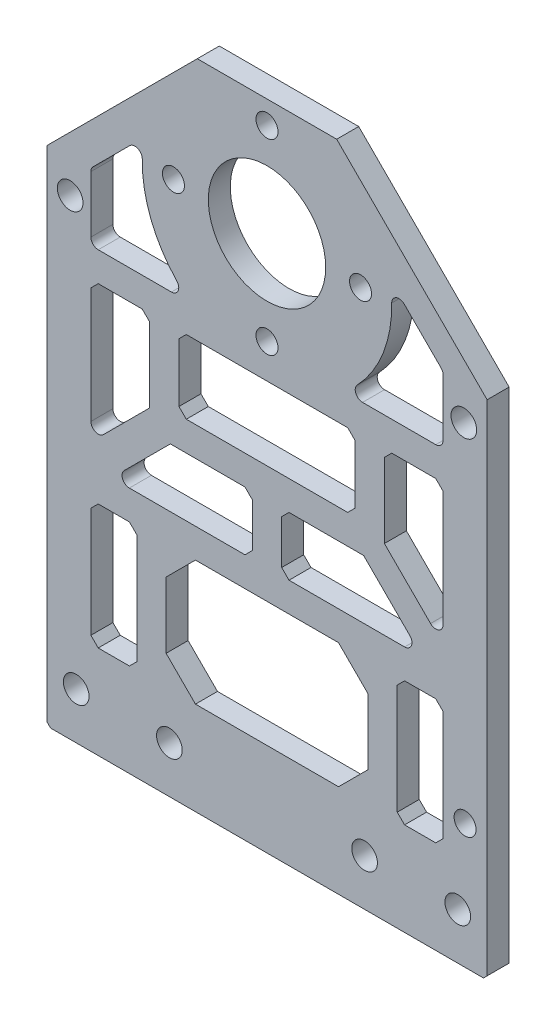
from build123d import *

# Parameters (mm, degrees)
ESBO_O1_R                = 16
RESSALTO_EXTRUS_O1_DEPTH = 6
ESBO_O2_R                = 3
ESBO_O2_W                = 55
ESBO_O2_H                = 34
ESBO_O2_W_2              = 48
ESBO_O2_H_2              = 20
ESBO_O2_W_3              = 12.5
CORTE_EXTRUS_O1_DEPTH    = 215.755675129
RESSALTO_EXTRUS_O2_DEPTH = 6
ESBO_O4_R                = 3.5
CORTE_EXTRUS_O2_DEPTH    = 215.755675129
FILETE1_R                = 2
CHANFRO1_SIZE            = 8
CHANFRO2_SIZE            = 2
ESBO_O5_R                = 3.5
CORTE_EXTRUS_O3_DEPTH    = 215.755675129
CHANFRO3_SIZE            = 1
ESBO_O8_R                = 3
CORTE_EXTRUS_O5_DEPTH    = 215.755675129


with BuildPart() as part:
    # Esboço1 → Ressalto-extrusão1 (new body)
    with BuildSketch(Plane.XY):
        Polygon((0, 0), (0, 137), (41, 178), (79, 178), (120, 137), (120, 0), align=None)
        with Locations((60, 146.25)):
            Circle(ESBO_O1_R, mode=Mode.SUBTRACT)
    extrude(amount=RESSALTO_EXTRUS_O1_DEPTH)

    # Esboço2 → Corte-extrusão1 (cut, through all)
    with BuildSketch(Plane(origin=(0, 0, 0), x_dir=(-1, 0, 0), z_dir=(0, 0, -1))):
        with Locations((-60, 171.75)):
            Circle(ESBO_O2_R)
        with Locations((-34.5, 146.25)):
            Circle(ESBO_O2_R)
        with Locations((-60, 120.75)):
            Circle(ESBO_O2_R)
        with Locations((-85.5, 146.25)):
            Circle(ESBO_O2_R)
        with Locations((-60, 42.4)):
            Rectangle(ESBO_O2_W, ESBO_O2_H)
        Polygon((-56, 83.4), (-28, 83.4), (-28, 111.4), (-12, 111.4), (-12, 67.4), (-56, 67.4), align=None)
        with Locations((-60, 101.4)):
            Rectangle(ESBO_O2_W_2, ESBO_O2_H_2)
        with Locations((-18.25, 42.4)):
            Rectangle(ESBO_O2_W_3, ESBO_O2_H)
        Polygon((-64, 83.4), (-64, 67.4), (-108, 67.4), (-108, 111.4), (-92, 111.4), (-92, 83.4), align=None)
        with Locations((-101.75, 42.4)):
            Rectangle(ESBO_O2_W_3, ESBO_O2_H)
        with BuildLine():
            Line((-93.472953207, 152.213338294), (-108, 137.686291501))
            Line((-108, 137.686291501), (-108, 119.4))
            Line((-108, 119.4), (-80.858511452, 119.4))
            ThreePointArc((-80.858511452, 119.4), (-91.735718134, 134.049828095), (-93.472953207, 152.213338294))
        make_face()
        with BuildLine():
            Line((-26.527046793, 152.213338294), (-12, 137.686291501))
            Line((-12, 137.686291501), (-12, 119.4))
            Line((-12, 119.4), (-39.141488548, 119.4))
            ThreePointArc((-39.141488548, 119.4), (-28.264281866, 134.049828095), (-26.527046793, 152.213338294))
        make_face()
    extrude(amount=-CORTE_EXTRUS_O1_DEPTH, mode=Mode.SUBTRACT)

    # Esboço3 → Ressalto-extrusão2 (add, through all)
    with BuildSketch(Plane.XY.offset(6)):
        Polygon((28, 89.056854249), (12, 73.056854249), (12, 67.4), (17.656854249, 67.4), (33.656854249, 83.4), (28, 83.4), align=None)
        Polygon((86.343145751, 83.4), (102.343145751, 67.4), (108, 67.4), (108, 73.056854249), (92, 89.056854249), (92, 83.4), align=None)
    extrude(amount=-RESSALTO_EXTRUS_O2_DEPTH)

    # Esboço4 → Corte-extrusão2 (cut, through all)
    with BuildSketch(Plane.XY.offset(6)):
        with Locations((8, 12.7)):
            Circle(ESBO_O4_R)
        with Locations((33.4, 12.7)):
            Circle(ESBO_O4_R)
        with Locations((86.6, 12.7)):
            Circle(ESBO_O4_R)
        with Locations((112, 12.7)):
            Circle(ESBO_O4_R)
    extrude(amount=-CORTE_EXTRUS_O2_DEPTH, mode=Mode.SUBTRACT)

    # Filete1
    filete1_edges = [part.edges().sort_by_distance(p)[0] for p in [
        (39.141488548, 119.4, 3),
        (26.527046793, 152.213338294, 3),
        (12, 137.686291501, 3),
        (12, 119.4, 3),
        (108, 73.056854249, 3),
        (102.343145751, 67.4, 3),
        (17.656854249, 67.4, 3),
        (12, 73.056854249, 3),
        (93.472953207, 152.213338294, 3),
        (80.858511452, 119.4, 3),
        (108, 119.4, 3),
        (108, 137.686291501, 3),
    ]]
    fillet(filete1_edges, radius=FILETE1_R)

    # Chanfro1
    chanfro1_edges = [part.edges().sort_by_distance(p)[0] for p in [
        (87.5, 25.4, 3),
        (87.5, 59.4, 3),
        (32.5, 59.4, 3),
        (32.5, 25.4, 3),
    ]]
    chamfer(chanfro1_edges, length=CHANFRO1_SIZE)

    # Chanfro2
    chanfro2_edges = [part.edges().sort_by_distance(p)[0] for p in [
        (64, 83.4, 3),
        (64, 67.4, 3),
        (108, 111.4, 3),
        (92, 111.4, 3),
        (84, 91.4, 3),
        (84, 111.4, 3),
        (36, 111.4, 3),
        (36, 91.4, 3),
        (95.5, 25.4, 3),
        (108, 25.4, 3),
        (108, 59.4, 3),
        (95.5, 59.4, 3),
        (24.5, 25.4, 3),
        (24.5, 59.4, 3),
        (12, 59.4, 3),
        (12, 25.4, 3),
        (28, 111.4, 3),
        (12, 111.4, 3),
        (56, 67.4, 3),
        (56, 83.4, 3),
    ]]
    chamfer(chanfro2_edges, length=CHANFRO2_SIZE)

    # Esboço5 → Corte-extrusão3 (cut, through all)
    with BuildSketch(Plane.XY.offset(6)):
        with Locations((6.35, 128.4)):
            Circle(ESBO_O5_R)
        with Locations(Location((113.65, 128.4, 0), (0, 0, 180))):
            Circle(ESBO_O5_R)
    extrude(amount=-CORTE_EXTRUS_O3_DEPTH, mode=Mode.SUBTRACT)

    # Chanfro3
    chanfro3_edges = [part.edges().sort_by_distance(p)[0] for p in [
        (0, 0, 3),
        (120, 0, 3),
    ]]
    chamfer(chanfro3_edges, length=CHANFRO3_SIZE)

    # Esboço8 → Corte-extrusão5 (cut, through all)
    with BuildSketch(Plane.XY.offset(6)):
        with Locations((114, 34)):
            Circle(ESBO_O8_R)
    extrude(amount=-CORTE_EXTRUS_O5_DEPTH, mode=Mode.SUBTRACT)


solid = part.part
